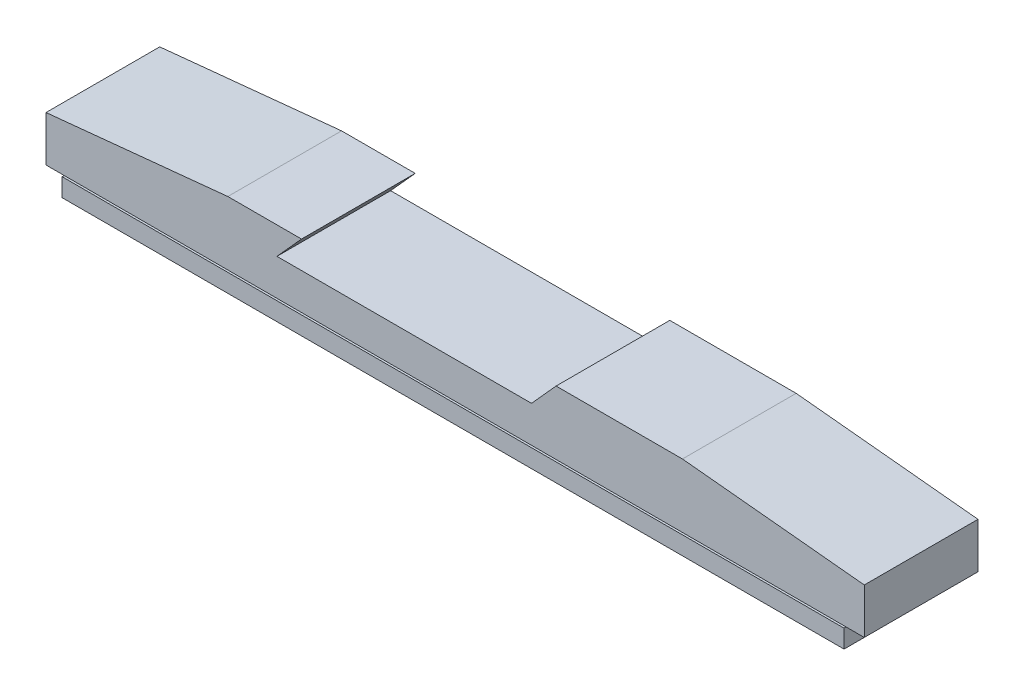
from build123d import *

# Parameters (mm, degrees)
BOSS_EXTRUDE1_DEPTH = 430
BOSS_EXTRUDE2_DEPTH = 450
CUT_EXTRUDE1_REACH  = 457.67


with BuildPart() as part:
    # Sketch1 → Boss-Extrude1 (new body)
    with BuildSketch(Plane(origin=(0, 0, 0), x_dir=(0, 0, -1), z_dir=(1, 0, 0))):
        Polygon((11.666666667, 0), (-11.666666667, 0), (-11.666666667, -10), (-22.4, -10), (-22.4, -20), (22.4, -20), (22.4, -10), (11.666666667, -10), align=None)
    extrude(amount=BOSS_EXTRUDE1_DEPTH)

    # Sketch1<3> → Boss-Extrude2 (add)
    with BuildSketch(Plane(origin=(0, 0, 0), x_dir=(0, 0, -1), z_dir=(1, 0, 0))):
        Polygon((31.266666667, 35), (-31.266666667, 35), (-31.266666667, 0), (-11.666666667, 0), (11.666666667, 0), (31.266666667, 0), align=None)
    extrude(amount=BOSS_EXTRUDE2_DEPTH)

    # Sketch2 → Cut-Extrude1 (cut, up to next)
    with BuildSketch(Plane.XY.offset(31.266666667), mode=Mode.PRIVATE) as cut_extrude1_sk1:
        Polygon((0, 35), (0, 25), (100, 35), align=None)
    cut_extrude1_tool1 = extrude(cut_extrude1_sk1.sketch, amount=-CUT_EXTRUDE1_REACH, mode=Mode.PRIVATE) & part.part
    # Sketch2 → Cut-Extrude1 (cut, up to next)
    with BuildSketch(Plane.XY.offset(31.266666667), mode=Mode.PRIVATE) as cut_extrude1_sk2:
        Polygon((450, 35), (350, 35), (450, 25), align=None)
    cut_extrude1_tool2 = extrude(cut_extrude1_sk2.sketch, amount=-CUT_EXTRUDE1_REACH, mode=Mode.PRIVATE) & part.part
    # Sketch2 → Cut-Extrude1 (cut, up to next)
    with BuildSketch(Plane.XY.offset(31.266666667), mode=Mode.PRIVATE) as cut_extrude1_sk3:
        Polygon((280.506060664, 35), (140.506060664, 35), (127, 20), (267, 20), align=None)
    cut_extrude1_tool3 = extrude(cut_extrude1_sk3.sketch, amount=-CUT_EXTRUDE1_REACH, mode=Mode.PRIVATE) & part.part
    add(cut_extrude1_tool1.solids().sort_by_distance((33.333333, 31.666667, 31.266667))[0], mode=Mode.SUBTRACT)
    add(cut_extrude1_tool2.solids().sort_by_distance((416.666667, 31.666667, 31.266667))[0], mode=Mode.SUBTRACT)
    add(cut_extrude1_tool3.solids().sort_by_distance((203.75303, 27.5, 31.266667))[0], mode=Mode.SUBTRACT)


solid = part.part
